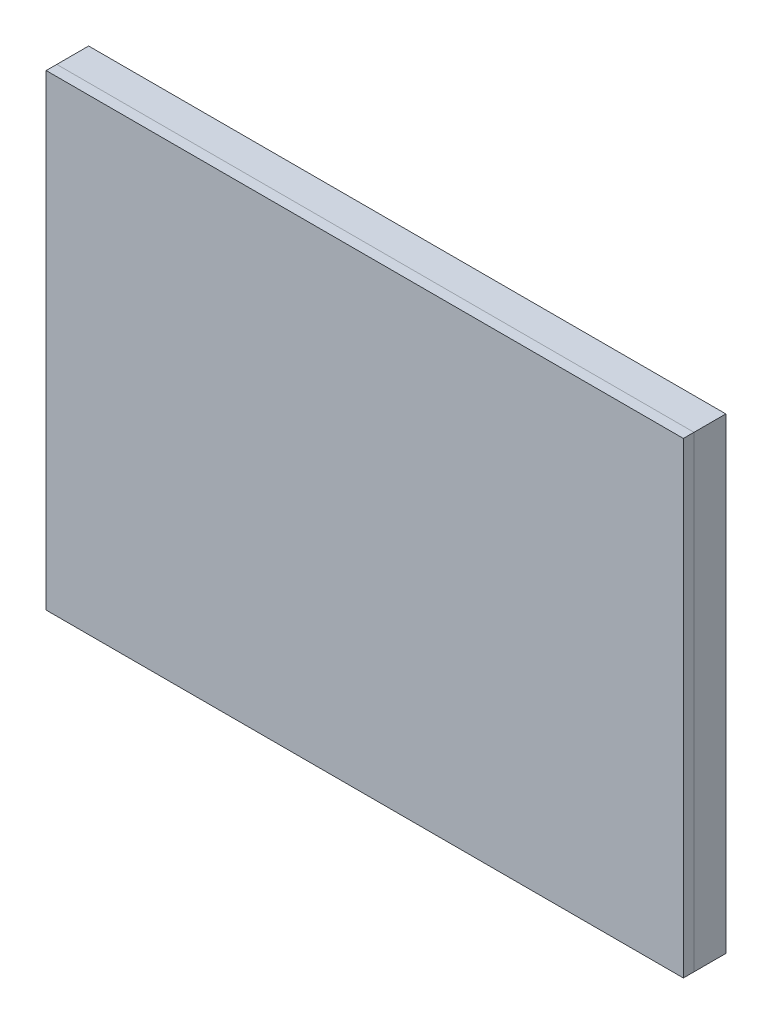
from build123d import *

# Parameters (mm, degrees)
SKETCH2_W           = 60
SKETCH2_H           = 44
BOSS_EXTRUDE1_DEPTH = 3
SKETCH3_W           = 60
SKETCH3_H           = 44
BOSS_EXTRUDE2_DEPTH = 1


with BuildPart() as part:
    # Sketch2 → Boss-Extrude1 (new body)
    with BuildSketch(Plane.XY):
        Rectangle(SKETCH2_W, SKETCH2_H)
    extrude(amount=BOSS_EXTRUDE1_DEPTH)


with BuildPart() as body_2:
    # Sketch3 → Boss-Extrude2 (new body)
    with BuildSketch(Plane.XY.offset(3)):
        Rectangle(SKETCH3_W, SKETCH3_H)
    extrude(amount=BOSS_EXTRUDE2_DEPTH)


solid = Compound([part.part, body_2.part])
